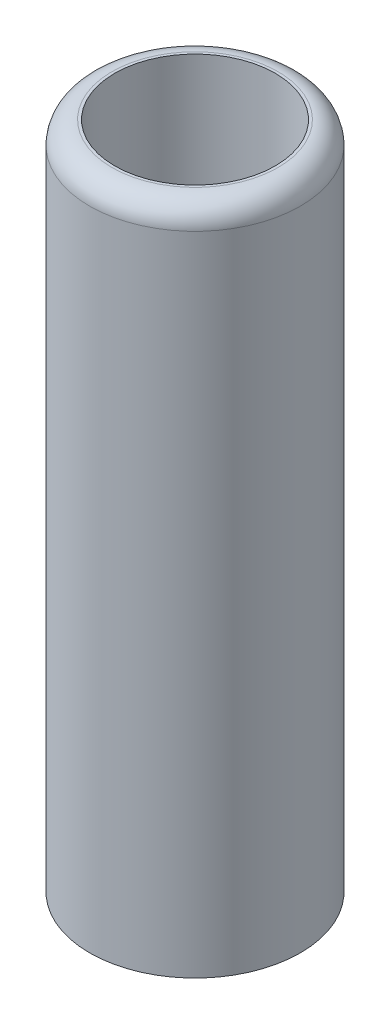
from build123d import *

# Parameters (mm, degrees)
SKETCH1_R           = 9.45
SKETCH1_R_2         = 7.2
BOSS_EXTRUDE1_DEPTH = 60
FILLET1_R           = 2


with BuildPart() as part:
    # Sketch1 → Boss-Extrude1 (new body)
    with BuildSketch(Plane(origin=(0, 0, 0), x_dir=(1, 0, 0), z_dir=(0, 1, 0))):
        with Locations(Location((0, 0, 0), (0, 0, 270))):
            Circle(SKETCH1_R)
        with Locations(Location((0, 0, 0), (0, 0, 270))):
            Circle(SKETCH1_R_2, mode=Mode.SUBTRACT)
    extrude(amount=BOSS_EXTRUDE1_DEPTH)

    # Fillet1
    fillet1_edges = [part.edges().sort_by_distance(p)[0] for p in [
        (0, 60, -9.45),
    ]]
    fillet(fillet1_edges, radius=FILLET1_R)


solid = part.part
